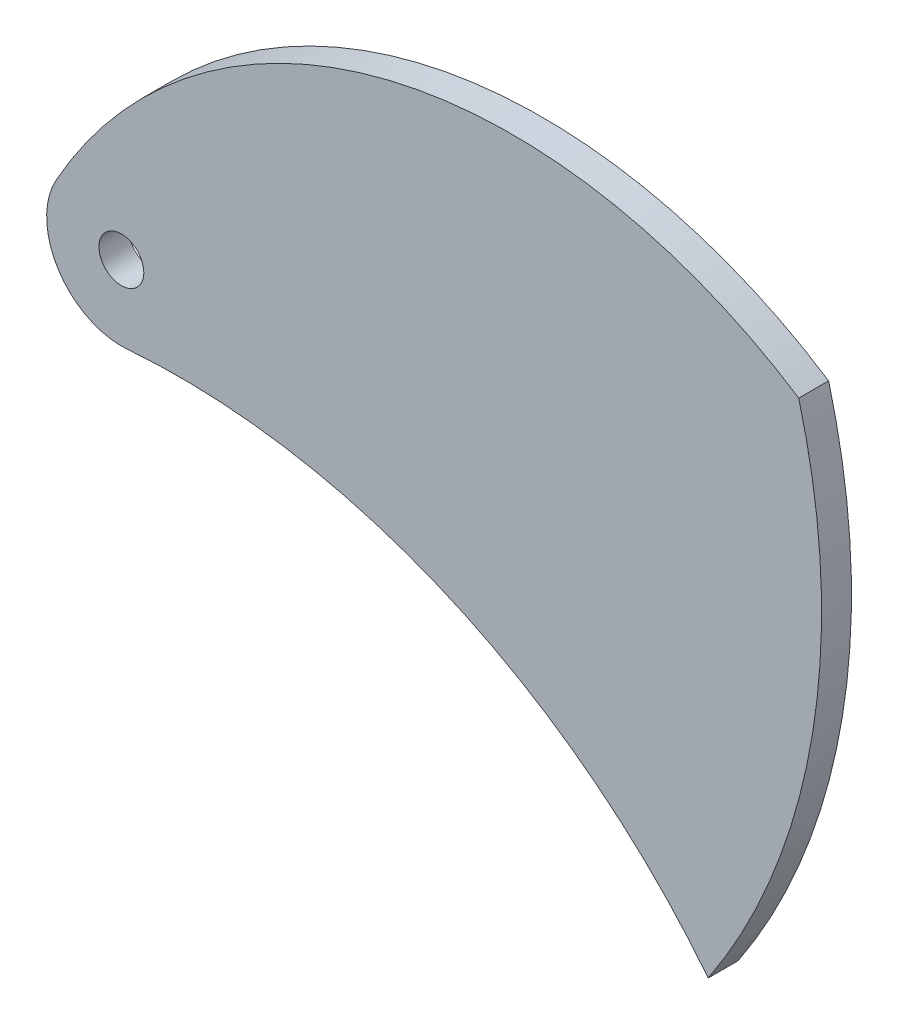
from build123d import *

# Parameters (mm, degrees)
SKETCH_1_R      = 1.5
EXTRUDE_1_DEPTH = 2


with BuildPart() as part:
    # 草圖1 → 填料-伸長1 (new body)
    with BuildSketch(Plane.XY):
        with BuildLine():
            ThreePointArc((-38.871013222, 17.001303806), (-17.306164288, 13.369084026), (0, 0))
            ThreePointArc((0, 0), (6.981013161, 17.661453415), (6.054619156, 36.629934525))
            ThreePointArc((6.054619156, 36.629934525), (-21.435485662, 41.318574281), (-43.626094088, 24.428751802))
            ThreePointArc((-43.626094088, 24.428751802), (-43.474451881, 19.289999171), (-38.871013222, 17.001303806))
        make_face()
        with Locations((-39.263484679, 21.985876622)):
            Circle(SKETCH_1_R, mode=Mode.SUBTRACT)
    extrude(amount=EXTRUDE_1_DEPTH)


solid = part.part
